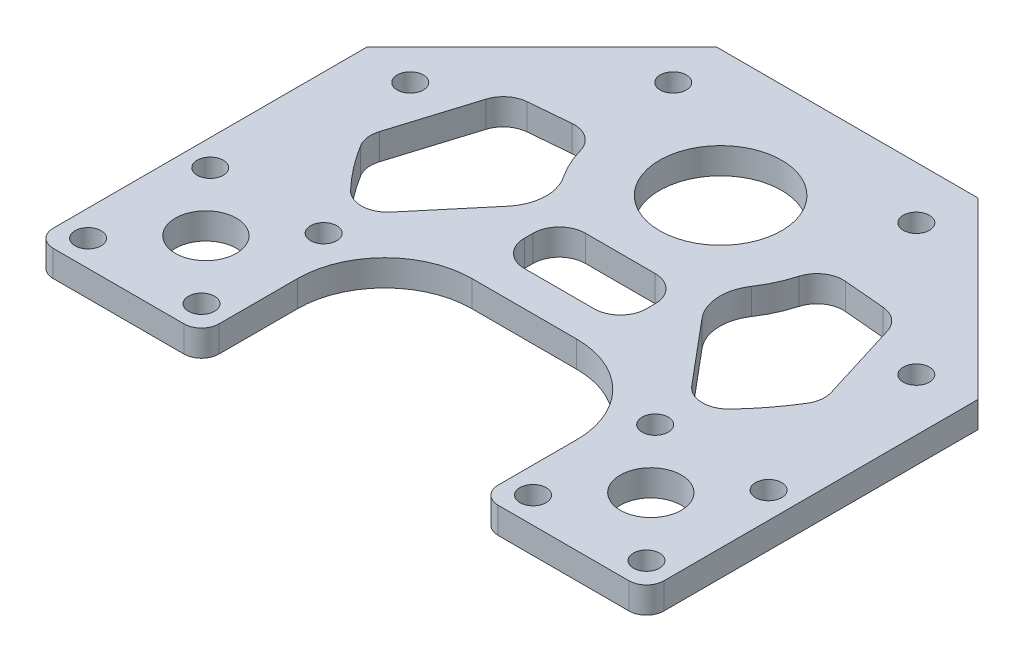
from build123d import *

# Parameters (mm, degrees)
SKETCH_1_W          = 70
SKETCH_1_H          = 58
SKETCH_1_R          = 7
EXTRUDE_1_DEPTH     = 3
CHAMFER_1_SIZE      = 20
SKETCH_2_W          = 32
SKETCH_2_H          = 21
CUT_EXTRUDE_1_DEPTH = 3
FILLET_1_R          = 10
SKETCH_3_R          = 1.5
CUT_EXTRUDE_2_DEPTH = 91.956033335
SKETCH_4_R          = 1.5
CUT_EXTRUDE_3_DEPTH = 91.956033335
FILLET_2_R          = 2
SKETCH_5_W          = 14
SKETCH_5_H          = 7
CUT_EXTRUDE_4_DEPTH = 91.956033335
FILLET_3_R          = 3
FILLET_4_R          = 5
SKETCH_6_R          = 3.5
CUT_EXTRUDE_5_DEPTH = 10


with BuildPart() as part:
    # 草图1 → 凸台-拉伸1 (new body)
    with BuildSketch(Plane(origin=(0, 0, 0), x_dir=(1, 0, 0), z_dir=(0, 1, 0))):
        with Locations((35, 29)):
            Rectangle(SKETCH_1_W, SKETCH_1_H)
        with Locations(Location((35, 43.5, 0), (0, 0, 270))):
            Circle(SKETCH_1_R, mode=Mode.SUBTRACT)
    extrude(amount=EXTRUDE_1_DEPTH)

    # 倒角1
    chamfer_1_edges = [part.edges().sort_by_distance(p)[0] for p in [
        (0, 1.5, -58),
        (70, 1.5, -58),
    ]]
    chamfer(chamfer_1_edges, length=CHAMFER_1_SIZE)

    # 草图2 → 切除-拉伸1 (cut)
    with BuildSketch(Plane(origin=(0, 3, 0), x_dir=(1, 0, 0), z_dir=(0, 1, 0))):
        with Locations((35, 10.5)):
            Rectangle(SKETCH_2_W, SKETCH_2_H)
    extrude(amount=-CUT_EXTRUDE_1_DEPTH, mode=Mode.SUBTRACT)

    # 圆角1
    fillet_1_edges = [part.edges().sort_by_distance(p)[0] for p in [
        (51, 1.5, -21),
        (19, 1.5, -21),
    ]]
    fillet(fillet_1_edges, radius=FILLET_1_R)

    # 草图3 → 切除-拉伸2 (cut, through all)
    with BuildSketch(Plane(origin=(0, 3, 0), x_dir=(1, 0, 0), z_dir=(0, 1, 0))):
        with Locations(Location((3, 17, 0), (0, 0, 270))):
            Circle(SKETCH_3_R)
        with Locations(Location((16, 17, 0), (0, 0, 270))):
            Circle(SKETCH_3_R)
        with Locations(Location((3, 3, 0), (0, 0, 270))):
            Circle(SKETCH_3_R)
        with Locations(Location((16, 3, 0), (0, 0, 270))):
            Circle(SKETCH_3_R)
        with Locations(Location((54, 3, 0), (0, 0, 90))):
            Circle(SKETCH_3_R)
        with Locations(Location((67, 3, 0), (0, 0, 90))):
            Circle(SKETCH_3_R)
        with Locations(Location((54, 17, 0), (0, 0, 90))):
            Circle(SKETCH_3_R)
        with Locations(Location((67, 17, 0), (0, 0, 90))):
            Circle(SKETCH_3_R)
    extrude(amount=-CUT_EXTRUDE_2_DEPTH, mode=Mode.SUBTRACT)

    # 草图4 → 切除-拉伸3 (cut, through all)
    with BuildSketch(Plane.XZ):
        with Locations(Location((21.071067812, -52, 0), (0, 0, 270))):
            Circle(SKETCH_4_R)
        with Locations(Location((6, -36.928932188, 0), (0, 0, 270))):
            Circle(SKETCH_4_R)
        with Locations(Location((64, -36.928932188, 0), (0, 0, 90))):
            Circle(SKETCH_4_R)
        with Locations(Location((48.928932188, -52, 0), (0, 0, 90))):
            Circle(SKETCH_4_R)
    extrude(amount=-CUT_EXTRUDE_3_DEPTH, mode=Mode.SUBTRACT)

    # 圆角2
    fillet_2_edges = [part.edges().sort_by_distance(p)[0] for p in [
        (51, 1.5, 0),
        (19, 1.5, 0),
        (70, 1.5, 0),
        (0, 1.5, 0),
    ]]
    fillet(fillet_2_edges, radius=FILLET_2_R)

    # 草图5 → 切除-拉伸4 (cut, through all)
    with BuildSketch(Plane.XZ):
        with BuildLine():
            Line((43.356238926, -33.541422239), (54.283628291, -20.518666706))
            ThreePointArc((54.283628291, -20.518666706), (58.175259711, -24.449873037), (61.27895346, -29.028766292))
            Line((61.27895346, -29.028766292), (57.414380707, -41.538995788))
            Line((57.414380707, -41.538995788), (47.950531075, -42.366975344))
            ThreePointArc((47.950531075, -42.366975344), (46.531140831, -37.497268028), (43.356238926, -33.541422239))
        make_face()
        with BuildLine():
            Line((26.643761074, -33.541422239), (15.716371709, -20.518666706))
            ThreePointArc((15.716371709, -20.518666706), (11.824740289, -24.449873037), (8.72104654, -29.028766292))
            Line((8.72104654, -29.028766292), (12.585619293, -41.538995788))
            Line((12.585619293, -41.538995788), (22.049468925, -42.366975344))
            ThreePointArc((22.049468925, -42.366975344), (23.468859169, -37.497268028), (26.643761074, -33.541422239))
        make_face()
        with Locations((35, -28.5)):
            Rectangle(SKETCH_5_W, SKETCH_5_H)
    extrude(amount=-CUT_EXTRUDE_4_DEPTH, mode=Mode.SUBTRACT)

    # 圆角3
    fillet_3_edges = [part.edges().sort_by_distance(p)[0] for p in [
        (22.049468925, 1.5, -42.366975344),
        (12.585619293, 1.5, -41.538995788),
        (8.72104654, 1.5, -29.028766292),
        (15.716371709, 1.5, -20.518666706),
        (54.283628291, 1.5, -20.518666706),
        (61.27895346, 1.5, -29.028766292),
        (57.414380707, 1.5, -41.538995788),
        (47.950531075, 1.5, -42.366975344),
        (42, 1.5, -25),
        (42, 1.5, -32),
        (28, 1.5, -32),
        (28, 1.5, -25),
    ]]
    fillet(fillet_3_edges, radius=FILLET_3_R)

    # 圆角4
    fillet_4_edges = [part.edges().sort_by_distance(p)[0] for p in [
        (26.643761074, 1.5, -33.541422239),
        (43.356238926, 1.5, -33.541422239),
    ]]
    fillet(fillet_4_edges, radius=FILLET_4_R)

    # 草图6 → 切除-拉伸5 (cut)
    with BuildSketch(Plane.XZ):
        with Locations(Location((9.5, -10, 0), (0, 0, 270))):
            Circle(SKETCH_6_R)
        with Locations(Location((60.5, -10, 0), (0, 0, 270))):
            Circle(SKETCH_6_R)
    extrude(amount=-CUT_EXTRUDE_5_DEPTH, mode=Mode.SUBTRACT)


solid = part.part
